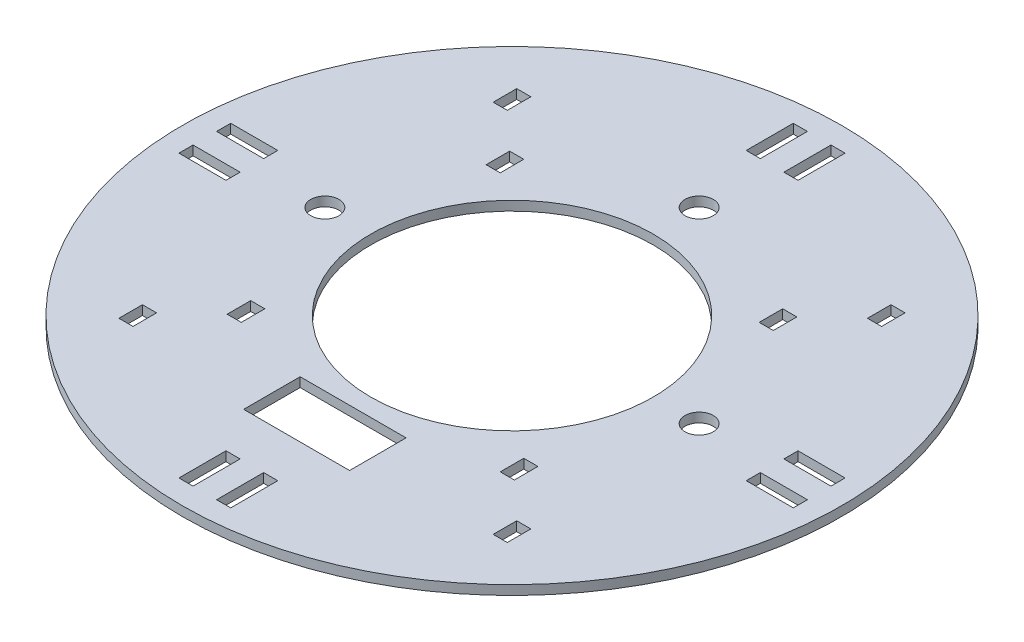
from build123d import *

# Parameters (mm, degrees)
SKETCH1_R                   = 70
SKETCH1_R_2                 = 30
SKETCH1_R_3                 = 3
SKETCH1_W                   = 2
SKETCH1_H                   = 5
SKETCH1_W_2                 = 22.5
SKETCH1_H_2                 = 12
SKETCH1_W_3                 = 5
SKETCH1_H_3                 = 2
Y_KSEKLIK_EKSTR_ZYON1_DEPTH = 2
SKETCH3_W                   = 2
SKETCH3_H                   = 2
SKETCH3_W_2                 = 3
BOSS_EXTRUDE1_DEPTH         = 2
SKETCH5_W                   = 5
SKETCH5_H                   = 2
CUT_EXTRUDE1_DEPTH          = 2
SKETCH6_W                   = 2
SKETCH6_H                   = 2
SKETCH6_W_2                 = 3
BOSS_EXTRUDE3_DEPTH         = 2
SKETCH8_W                   = 5
SKETCH8_H                   = 2
CUT_EXTRUDE2_DEPTH          = 2
SKETCH9_W                   = 2
SKETCH9_H                   = 2
SKETCH9_H_2                 = 3
BOSS_EXTRUDE4_DEPTH         = 2
SKETCH10_W                  = 2
SKETCH10_H                  = 2
SKETCH10_H_2                = 3
BOSS_EXTRUDE5_DEPTH         = 2
SKETCH12_W                  = 2
SKETCH12_H                  = 5
CUT_EXTRUDE4_DEPTH          = 2
SKETCH13_W                  = 2
SKETCH13_H                  = 5
CUT_EXTRUDE5_DEPTH          = 2
SKETCH14_W                  = 3
SKETCH14_H                  = 2
SKETCH14_W_2                = 2
BOSS_EXTRUDE6_DEPTH         = 2
SKETCH15_W                  = 5
SKETCH15_H                  = 2
CUT_EXTRUDE6_DEPTH          = 2
SKETCH16_W                  = 3
SKETCH16_H                  = 2
SKETCH16_W_2                = 2
BOSS_EXTRUDE9_DEPTH         = 2
SKETCH17_W                  = 5
SKETCH17_H                  = 2
CUT_EXTRUDE7_DEPTH          = 2
SKETCH18_W                  = 2
SKETCH18_H                  = 3
SKETCH18_H_2                = 2
BOSS_EXTRUDE10_DEPTH        = 2
SKETCH19_W                  = 2
SKETCH19_H                  = 5
CUT_EXTRUDE8_DEPTH          = 2
SKETCH20_W                  = 3
SKETCH20_H                  = 10
SKETCH20_W_2                = 10
SKETCH20_H_2                = 3
SKETCH20_H_3                = 5
CUT_EXTRUDE9_DEPTH          = 2


with BuildPart() as part:
    # Sketch1 → Yükseklik-Ekstrüzyon1 (new body)
    with BuildSketch(Plane(origin=(0, 0, 0), x_dir=(1, 0, 0), z_dir=(0, 1, 0))):
        with Locations(Location((0, 0, 0), (0, 0, 270))):
            Circle(SKETCH1_R)
        with Locations(Location((0, 0, 0), (0, 0, 270))):
            Circle(SKETCH1_R_2, mode=Mode.SUBTRACT)
        with Locations(Location((39.748737342, 0, 0), (0, 0, 270))):
            Circle(SKETCH1_R_3, mode=Mode.SUBTRACT)
        with Locations(Location((-39.748737342, 0, 0), (0, 0, 270))):
            Circle(SKETCH1_R_3, mode=Mode.SUBTRACT)
        with Locations(Location((0, 39.748737342, 0), (0, 0, 270))):
            Circle(SKETCH1_R_3, mode=Mode.SUBTRACT)
        with Locations((-29, 27.5)):
            Rectangle(SKETCH1_W, SKETCH1_H, mode=Mode.SUBTRACT)
        with Locations((29, 27.5)):
            Rectangle(SKETCH1_W, SKETCH1_H, mode=Mode.SUBTRACT)
        with Locations((-29, -27.5)):
            Rectangle(SKETCH1_W, SKETCH1_H, mode=Mode.SUBTRACT)
        with Locations((29, -27.5)):
            Rectangle(SKETCH1_W, SKETCH1_H, mode=Mode.SUBTRACT)
        with Locations((-39.748737342, 39.748737342)):
            Rectangle(SKETCH1_W, SKETCH1_H, mode=Mode.SUBTRACT)
        with Locations((39.748737342, 39.748737342)):
            Rectangle(SKETCH1_W, SKETCH1_H, mode=Mode.SUBTRACT)
        with Locations((39.748737342, -39.748737342)):
            Rectangle(SKETCH1_W, SKETCH1_H, mode=Mode.SUBTRACT)
        with Locations((-39.748737342, -39.748737342)):
            Rectangle(SKETCH1_W, SKETCH1_H, mode=Mode.SUBTRACT)
        with Locations((0, -39.748737342)):
            Rectangle(SKETCH1_W_2, SKETCH1_H_2, mode=Mode.SUBTRACT)
        with Locations((-64.748737342, 4)):
            Rectangle(SKETCH1_W_3, SKETCH1_H_3, mode=Mode.SUBTRACT)
        with Locations((-64.748737342, -4)):
            Rectangle(SKETCH1_W_3, SKETCH1_H_3, mode=Mode.SUBTRACT)
        with Locations((-54.748737342, -4)):
            Rectangle(SKETCH1_W_3, SKETCH1_H_3, mode=Mode.SUBTRACT)
        with Locations((-54.748737342, 4)):
            Rectangle(SKETCH1_W_3, SKETCH1_H_3, mode=Mode.SUBTRACT)
        with Locations((-4, 64.748737342)):
            Rectangle(SKETCH1_W, SKETCH1_H, mode=Mode.SUBTRACT)
        with Locations((-4, 54.748737342)):
            Rectangle(SKETCH1_W, SKETCH1_H, mode=Mode.SUBTRACT)
        with Locations((4, 54.748737342)):
            Rectangle(SKETCH1_W, SKETCH1_H, mode=Mode.SUBTRACT)
        with Locations((4, 64.748737342)):
            Rectangle(SKETCH1_W, SKETCH1_H, mode=Mode.SUBTRACT)
        with Locations((54.748737342, 4)):
            Rectangle(SKETCH1_W_3, SKETCH1_H_3, mode=Mode.SUBTRACT)
        with Locations((54.748737342, -4)):
            Rectangle(SKETCH1_W_3, SKETCH1_H_3, mode=Mode.SUBTRACT)
        with Locations((64.748737342, 4)):
            Rectangle(SKETCH1_W_3, SKETCH1_H_3, mode=Mode.SUBTRACT)
        with Locations((64.748737342, -4)):
            Rectangle(SKETCH1_W_3, SKETCH1_H_3, mode=Mode.SUBTRACT)
        with Locations((-4, -54.748737342)):
            Rectangle(SKETCH1_W, SKETCH1_H, mode=Mode.SUBTRACT)
        with Locations((4, -54.748737342)):
            Rectangle(SKETCH1_W, SKETCH1_H, mode=Mode.SUBTRACT)
        with Locations((4, -64.748737342)):
            Rectangle(SKETCH1_W, SKETCH1_H, mode=Mode.SUBTRACT)
        with Locations((-4, -64.748737342)):
            Rectangle(SKETCH1_W, SKETCH1_H, mode=Mode.SUBTRACT)
    extrude(amount=Y_KSEKLIK_EKSTR_ZYON1_DEPTH)

    # Sketch3 → Boss-Extrude1 (add)
    with BuildSketch(Plane(origin=(0, 2, 0), x_dir=(1, 0, 0), z_dir=(0, 1, 0))):
        with Locations((-66.248737342, 4)):
            Rectangle(SKETCH3_W, SKETCH3_H)
        with Locations((-53.748737342, 4)):
            Rectangle(SKETCH3_W_2, SKETCH3_H)
    extrude(amount=-BOSS_EXTRUDE1_DEPTH)

    # Sketch5 → Cut-Extrude1 (cut)
    with BuildSketch(Plane(origin=(0, 2, 0), x_dir=(1, 0, 0), z_dir=(0, 1, 0))):
        with Locations((-59.748737342, 4)):
            Rectangle(SKETCH5_W, SKETCH5_H)
    extrude(amount=-CUT_EXTRUDE1_DEPTH, mode=Mode.SUBTRACT)

    # Sketch6 → Boss-Extrude3 (add)
    with BuildSketch(Plane(origin=(0, 2, 0), x_dir=(1, 0, 0), z_dir=(0, 1, 0))):
        with Locations((-66.248737342, -4)):
            Rectangle(SKETCH6_W, SKETCH6_H)
        with Locations((-53.748737342, -4)):
            Rectangle(SKETCH6_W_2, SKETCH6_H)
    extrude(amount=-BOSS_EXTRUDE3_DEPTH)

    # Sketch8 → Cut-Extrude2 (cut)
    with BuildSketch(Plane(origin=(0, 2, 0), x_dir=(1, 0, 0), z_dir=(0, 1, 0))):
        with Locations((-59.748737342, -4)):
            Rectangle(SKETCH8_W, SKETCH8_H)
    extrude(amount=-CUT_EXTRUDE2_DEPTH, mode=Mode.SUBTRACT)

    # Sketch9 → Boss-Extrude4 (add)
    with BuildSketch(Plane(origin=(0, 2, 0), x_dir=(1, 0, 0), z_dir=(0, 1, 0))):
        with Locations((4, 66.248737342)):
            Rectangle(SKETCH9_W, SKETCH9_H)
        with Locations((4, 53.748737342)):
            Rectangle(SKETCH9_W, SKETCH9_H_2)
    extrude(amount=-BOSS_EXTRUDE4_DEPTH)

    # Sketch10 → Boss-Extrude5 (add)
    with BuildSketch(Plane(origin=(0, 2, 0), x_dir=(1, 0, 0), z_dir=(0, 1, 0))):
        with Locations((-4, 66.248737342)):
            Rectangle(SKETCH10_W, SKETCH10_H)
        with Locations((-4, 53.748737342)):
            Rectangle(SKETCH10_W, SKETCH10_H_2)
    extrude(amount=-BOSS_EXTRUDE5_DEPTH)

    # Sketch12 → Cut-Extrude4 (cut)
    with BuildSketch(Plane(origin=(0, 2, 0), x_dir=(1, 0, 0), z_dir=(0, 1, 0))):
        with Locations((-4, 59.748737342)):
            Rectangle(SKETCH12_W, SKETCH12_H)
    extrude(amount=-CUT_EXTRUDE4_DEPTH, mode=Mode.SUBTRACT)

    # Sketch13 → Cut-Extrude5 (cut)
    with BuildSketch(Plane(origin=(0, 2, 0), x_dir=(1, 0, 0), z_dir=(0, 1, 0))):
        with Locations((4, 59.748737342)):
            Rectangle(SKETCH13_W, SKETCH13_H)
    extrude(amount=-CUT_EXTRUDE5_DEPTH, mode=Mode.SUBTRACT)

    # Sketch14 → Boss-Extrude6 (add)
    with BuildSketch(Plane(origin=(0, 2, 0), x_dir=(1, 0, 0), z_dir=(0, 1, 0))):
        with Locations((53.748737342, 4)):
            Rectangle(SKETCH14_W, SKETCH14_H)
        with Locations((66.248737342, 4)):
            Rectangle(SKETCH14_W_2, SKETCH14_H)
    extrude(amount=-BOSS_EXTRUDE6_DEPTH)

    # Sketch15 → Cut-Extrude6 (cut)
    with BuildSketch(Plane(origin=(0, 2, 0), x_dir=(1, 0, 0), z_dir=(0, 1, 0))):
        with Locations((59.748737342, 4)):
            Rectangle(SKETCH15_W, SKETCH15_H)
    extrude(amount=-CUT_EXTRUDE6_DEPTH, mode=Mode.SUBTRACT)

    # Sketch16 → Boss-Extrude9 (add)
    with BuildSketch(Plane(origin=(0, 2, 0), x_dir=(1, 0, 0), z_dir=(0, 1, 0))):
        with Locations((53.748737342, -4)):
            Rectangle(SKETCH16_W, SKETCH16_H)
        with Locations((66.248737342, -4)):
            Rectangle(SKETCH16_W_2, SKETCH16_H)
    extrude(amount=-BOSS_EXTRUDE9_DEPTH)

    # Sketch17 → Cut-Extrude7 (cut)
    with BuildSketch(Plane(origin=(0, 2, 0), x_dir=(1, 0, 0), z_dir=(0, 1, 0))):
        with Locations((59.748737342, -4)):
            Rectangle(SKETCH17_W, SKETCH17_H)
    extrude(amount=-CUT_EXTRUDE7_DEPTH, mode=Mode.SUBTRACT)

    # Sketch18 → Boss-Extrude10 (add)
    with BuildSketch(Plane(origin=(0, 2, 0), x_dir=(1, 0, 0), z_dir=(0, 1, 0))):
        with Locations((-4, -53.748737342)):
            Rectangle(SKETCH18_W, SKETCH18_H)
        with Locations((-4, -66.248737342)):
            Rectangle(SKETCH18_W, SKETCH18_H_2)
        with Locations((4, -66.248737342)):
            Rectangle(SKETCH18_W, SKETCH18_H_2)
        with Locations((4, -53.748737342)):
            Rectangle(SKETCH18_W, SKETCH18_H)
    extrude(amount=-BOSS_EXTRUDE10_DEPTH)

    # Sketch19 → Cut-Extrude8 (cut)
    with BuildSketch(Plane(origin=(0, 2, 0), x_dir=(1, 0, 0), z_dir=(0, 1, 0))):
        with Locations((4, -59.748737342)):
            Rectangle(SKETCH19_W, SKETCH19_H)
        with Locations((-4, -59.748737342)):
            Rectangle(SKETCH19_W, SKETCH19_H)
    extrude(amount=-CUT_EXTRUDE8_DEPTH, mode=Mode.SUBTRACT)

    # Sketch20 → Cut-Extrude9 (cut)
    with BuildSketch(Plane(origin=(0, 2, 0), x_dir=(1, 0, 0), z_dir=(0, 1, 0))):
        with Locations((-4, 60.248737342)):
            Rectangle(SKETCH20_W, SKETCH20_H)
        with Locations((4, 60.248737342)):
            Rectangle(SKETCH20_W, SKETCH20_H)
        with Locations((60.248737342, 4)):
            Rectangle(SKETCH20_W_2, SKETCH20_H_2)
        with Locations((60.248737342, -4)):
            Rectangle(SKETCH20_W_2, SKETCH20_H_2)
        with Locations((4, -60.248737342)):
            Rectangle(SKETCH20_W, SKETCH20_H)
        with Locations((-4, -60.248737342)):
            Rectangle(SKETCH20_W, SKETCH20_H)
        with Locations((-60.248737342, 4)):
            Rectangle(SKETCH20_W_2, SKETCH20_H_2)
        with Locations((-60.248737342, -4)):
            Rectangle(SKETCH20_W_2, SKETCH20_H_2)
        with Locations((-29, 27.5)):
            Rectangle(SKETCH20_W, SKETCH20_H_3)
        with Locations((-39.748737342, 39.748737342)):
            Rectangle(SKETCH20_W, SKETCH20_H_3)
        with Locations((29, 27.5)):
            Rectangle(SKETCH20_W, SKETCH20_H_3)
        with Locations((39.748737342, 39.748737342)):
            Rectangle(SKETCH20_W, SKETCH20_H_3)
        with Locations((29, -27.5)):
            Rectangle(SKETCH20_W, SKETCH20_H_3)
        with Locations((39.748737342, -39.748737342)):
            Rectangle(SKETCH20_W, SKETCH20_H_3)
        with Locations((-29, -27.5)):
            Rectangle(SKETCH20_W, SKETCH20_H_3)
        with Locations((-39.748737342, -39.748737342)):
            Rectangle(SKETCH20_W, SKETCH20_H_3)
    extrude(amount=-CUT_EXTRUDE9_DEPTH, mode=Mode.SUBTRACT)


solid = part.part
